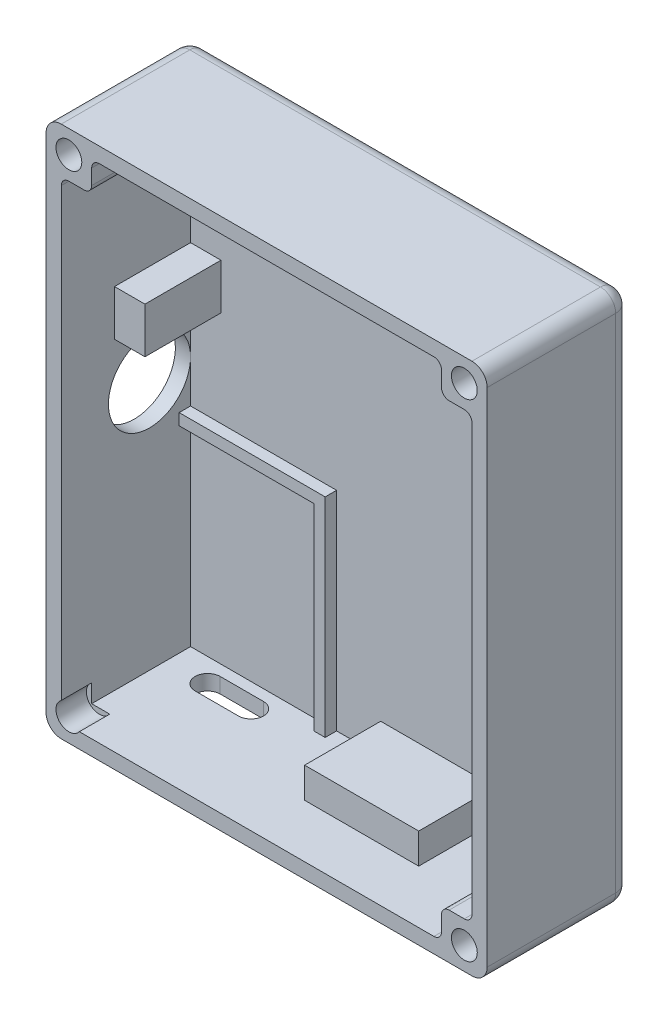
from build123d import *

# Parameters (mm, degrees)
SKETCH_1_W          = 58
SKETCH_1_H          = 70
EXTRUDE_1_DEPTH     = 18.9
CUT_EXTRUDE_1_DEPTH = 17
SKETCH_2_3_R        = 1.7
CUT_EXTRUDE_2_DEPTH = 4
FILLET_1_R          = 1
FILLET_2_R          = 2
SKETCH_4_R          = 1.5
CUT_EXTRUDE_3_DEPTH = 2
SKETCH_4_3_W        = 15
SKETCH_4_3_H        = 4
SKETCH_4_3_W_2      = 4
SKETCH_4_3_H_2      = 6
SKETCH_4_3_W_3      = 9
EXTRUDE_2_DEPTH     = 10
SKETCH_7_R          = 5.4
CUT_EXTRUDE_4_DEPTH = 2
CUT_EXTRUDE_5_DEPTH = 2
EXTRUDE_3_DEPTH     = 1.5


with BuildPart() as part:
    # Эскиз1 → Бобышка-Вытянуть1 (new body)
    with BuildSketch(Plane.XY):
        Rectangle(SKETCH_1_W, SKETCH_1_H)
    extrude(amount=EXTRUDE_1_DEPTH)

    # Эскиз2 → Вырез-Вытянуть1 (cut)
    with BuildSketch(Plane.XY.offset(18.9)):
        Polygon((-27, 29), (-27, -33), (23, -33), (23, -29), (27, -29), (27, 29), (23, 29), (23, 33), (-23, 33), (-23, 29), align=None)
    extrude(amount=-CUT_EXTRUDE_1_DEPTH, mode=Mode.SUBTRACT)

    # Эскиз2<3> → Вырез-Вытянуть2 (cut)
    with BuildSketch(Plane.XY.offset(18.9)):
        with Locations((-26, 32)):
            Circle(SKETCH_2_3_R)
        with Locations((26, 32)):
            Circle(SKETCH_2_3_R)
        with Locations((26, -32)):
            Circle(SKETCH_2_3_R)
        with Locations((-26, -32)):
            Circle(SKETCH_2_3_R)
    extrude(amount=-CUT_EXTRUDE_2_DEPTH, mode=Mode.SUBTRACT)

    # Скругление1
    fillet_1_edges = [part.edges().sort_by_distance(p)[0] for p in [
        (23, -33, 10.4),
        (23, -29, 10.4),
        (27, -29, 10.4),
        (23, 33, 10.4),
        (27, 29, 10.4),
        (-23, 33, 10.4),
        (-27, 29, 10.4),
        (23, 29, 10.4),
        (-23, 29, 10.4),
    ]]
    fillet(fillet_1_edges, radius=FILLET_1_R)

    # Скругление2
    fillet_2_edges = [part.edges().sort_by_distance(p)[0] for p in [
        (0, 35, 0),
        (-29, 0, 0),
        (0, -35, 0),
        (29, 0, 0),
        (29, 35, 9.45),
        (-29, 35, 9.45),
        (-29, -35, 9.45),
        (29, -35, 9.45),
    ]]
    fillet(fillet_2_edges, radius=FILLET_2_R)

    # Эскиз4 → Вырез-Вытянуть3 (cut)
    with BuildSketch(Plane.XY.offset(1.9)):
        with Locations((-20.9, 21.7)):
            Circle(SKETCH_4_R)
    extrude(amount=-CUT_EXTRUDE_3_DEPTH, mode=Mode.SUBTRACT)

    # Эскиз4<3> → Бобышка-Вытянуть2 (add)
    with BuildSketch(Plane.XY.offset(1.9)):
        with Locations((5.5, -31)):
            Rectangle(SKETCH_4_3_W, SKETCH_4_3_H)
        with Locations((-25, 10)):
            Rectangle(SKETCH_4_3_W_2, SKETCH_4_3_H_2)
        with Locations((9.5, 30)):
            Rectangle(SKETCH_4_3_W_3, SKETCH_4_3_H_2)
    extrude(amount=EXTRUDE_2_DEPTH)

    # Эскиз7 → Вырез-Вытянуть4 (cut)
    with BuildSketch(Plane.ZY.offset(29)):
        with Locations((7.3, 0)):
            Circle(SKETCH_7_R)
    extrude(amount=-CUT_EXTRUDE_4_DEPTH, mode=Mode.SUBTRACT)

    # Эскиз8 → Вырез-Вытянуть5 (cut)
    with BuildSketch(Plane.XZ.offset(35)):
        with BuildLine():
            Line((-21.65, 6.65), (-15.95, 6.65))
            ThreePointArc((-15.95, 6.65), (-14.3, 5), (-15.95, 3.35))
            Line((-15.95, 3.35), (-21.65, 3.35))
            ThreePointArc((-21.65, 3.35), (-23.3, 5), (-21.65, 6.65))
        make_face()
    extrude(amount=-CUT_EXTRUDE_5_DEPTH, mode=Mode.SUBTRACT)

    # Эскиз10 → Бобышка-Вытянуть3 (add)
    with BuildSketch(Plane.XY.offset(1.9)):
        Polygon((-9.3, -7.1), (-9.3, -33), (-7.8, -33), (-7.8, -5.6), (-27, -5.6), (-27, -7.1), align=None)
    extrude(amount=EXTRUDE_3_DEPTH)


solid = part.part
